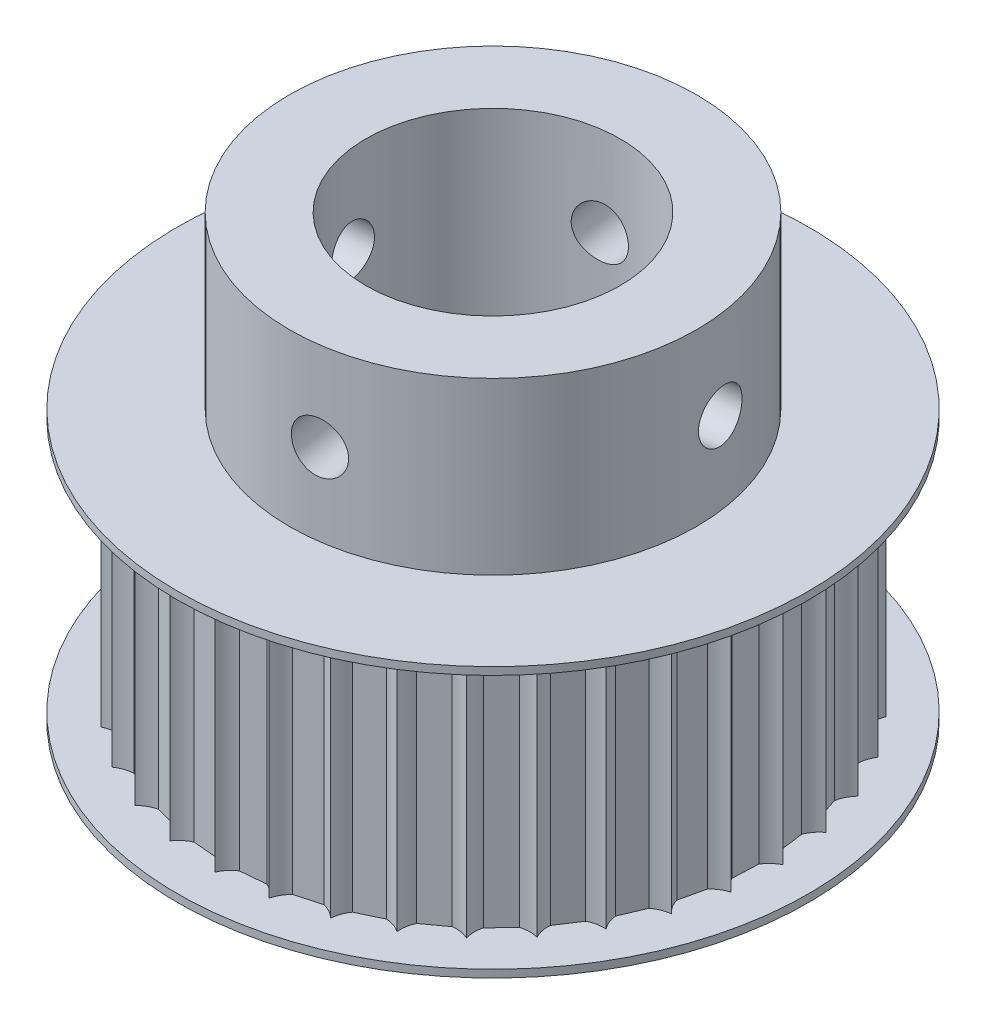
from build123d import *

# Parameters (mm, degrees)
CUT_EXTRUDE2_DEPTH  = 23.181073013
CIRPATTERN3_COUNT   = 35
SKETCH3_R           = 12.4
BOSS_EXTRUDE1_DEPTH = 0.3
BOSS_EXTRUDE2_START = 0.3
SKETCH4_R           = 12.4
BOSS_EXTRUDE2_DEPTH = 0.3
SKETCH5_R           = 4
CUT_EXTRUDE3_DEPTH  = 25.633513757
SKETCH7_R           = 1
CUT_EXTRUDE4_DEPTH  = 32.541832643
CIRPATTERN4_COUNT   = 4
SKETCH8_R           = 5
CUT_EXTRUDE5_DEPTH  = 25.633513757


with BuildPart() as part:
    # Sketch1 → Revolve1 (revolve)
    with BuildSketch(Plane.XY, mode=Mode.PRIVATE) as revolve1_sk:
        Polygon((4, 0), (14, 0), (14, 10), (8, 10), (8, 17), (4, 17), align=None)
    revolve(revolve1_sk.sketch.rotate(Axis((0, 0, 0), (0, 1, 0)), 90), axis=Axis((0, 0, 0), (0, 1, 0)))

    # Sketch2 → Cut-Extrude2 (cut, through all)
    with BuildSketch(Plane(origin=(0, 10, 0), x_dir=(1, 0, 0), z_dir=(0, 1, 0))):
        with BuildLine():
            Line((-0.5, 10.4), (0.5, 10.4))
            ThreePointArc((0.5, 10.4), (1.016757798, 10.955954335), (1.096537339, 11.710778202))
            ThreePointArc((1.096537339, 11.710778202), (1.185419495, 11.925358707), (1.4, 12.014240862))
            Line((1.4, 12.014240862), (1.4, 14.364345059))
            Line((1.4, 14.364345059), (-1.4, 14.364345059))
            Line((-1.4, 14.364345059), (-1.4, 12.014240862))
            ThreePointArc((-1.4, 12.014240862), (-1.185419495, 11.925358707), (-1.096537339, 11.710778202))
            ThreePointArc((-1.096537339, 11.710778202), (-1.016757798, 10.955954335), (-0.5, 10.4))
        make_face()
    cut_extrude2 = extrude(amount=-CUT_EXTRUDE2_DEPTH, mode=Mode.SUBTRACT)

    # CirPattern3: Cut-Extrude2 ×35 about axis
    cirpattern3_axis = Axis((0, 0, 0), (0, 1, 0))
    for i in range(1, CIRPATTERN3_COUNT):
        add(cut_extrude2.rotate(cirpattern3_axis, i * 360 / CIRPATTERN3_COUNT), mode=Mode.SUBTRACT)

    # Sketch3 → Boss-Extrude1 (add)
    with BuildSketch(Plane(origin=(0, 10, 0), x_dir=(1, 0, 0), z_dir=(0, 1, 0))):
        with Locations(Location((0, 0, 0), (0, 0, 270))):
            Circle(SKETCH3_R)
    extrude(amount=BOSS_EXTRUDE1_DEPTH)

    # Sketch4 → Boss-Extrude2 (add)
    with BuildSketch(Plane.XZ.offset(BOSS_EXTRUDE2_START)):
        with Locations(Location((0, 0, 0), (0, 0, 90))):
            Circle(SKETCH4_R)
    extrude(amount=-BOSS_EXTRUDE2_DEPTH)

    # Sketch5 → Cut-Extrude3 (cut, through all)
    with BuildSketch(Plane.XZ.offset(0.3)):
        with Locations(Location((0, 0, 0), (0, 0, 270))):
            Circle(SKETCH5_R)
    extrude(amount=-CUT_EXTRUDE3_DEPTH, mode=Mode.SUBTRACT)

    # Sketch7 → Cut-Extrude4 (cut, through all)
    with BuildSketch(Plane(origin=(10.305877522, 0, -1.396025965), x_dir=(-0.13423326581766673, 0, -0.9909497617679333), z_dir=(0.9909497617679333, 0, -0.13423326581766673))):
        with Locations((0, 13.5)):
            Circle(SKETCH7_R)
    cut_extrude4 = extrude(amount=-CUT_EXTRUDE4_DEPTH, mode=Mode.SUBTRACT)

    # CirPattern4: Cut-Extrude4 ×4 about axis
    cirpattern4_axis = Axis((0, 0, 0), (0, -1, 0))
    for i in range(1, CIRPATTERN4_COUNT):
        add(cut_extrude4.rotate(cirpattern4_axis, i * 360 / CIRPATTERN4_COUNT), mode=Mode.SUBTRACT)

    # Sketch8 → Cut-Extrude5 (cut, through all)
    with BuildSketch(Plane(origin=(0, 17, 0), x_dir=(1, 0, 0), z_dir=(0, 1, 0))):
        with Locations(Location((0, 0, 0), (0, 0, 270))):
            Circle(SKETCH8_R)
    extrude(amount=-CUT_EXTRUDE5_DEPTH, mode=Mode.SUBTRACT)


solid = part.part
